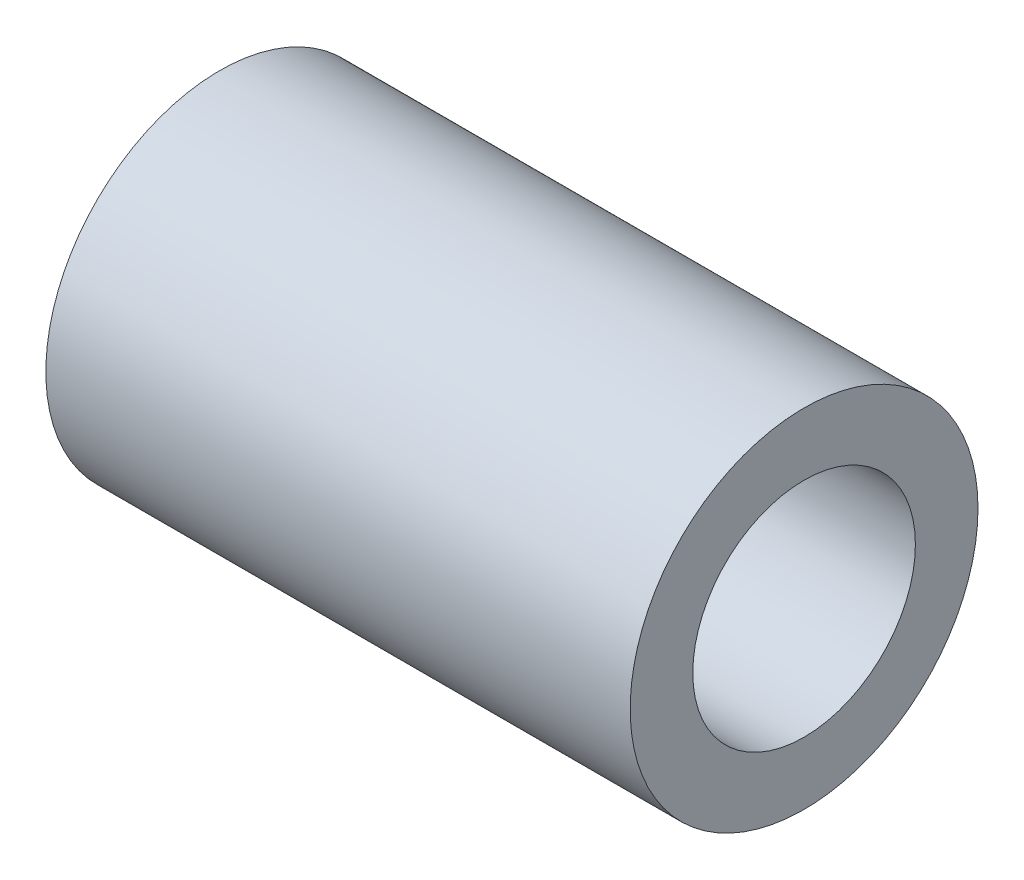
from build123d import *

# Parameters (mm, degrees)
SKETCH_1_R      = 2.5
SKETCH_1_R_2    = 1.6
EXTRUDE_1_DEPTH = 8.4


with BuildPart() as part:
    # 草图1 → 凸台-拉伸1 (new body)
    with BuildSketch(Plane(origin=(0, 0, 0), x_dir=(0, 0, -1), z_dir=(1, 0, 0))):
        Circle(SKETCH_1_R)
        Circle(SKETCH_1_R_2, mode=Mode.SUBTRACT)
    extrude(amount=EXTRUDE_1_DEPTH)


solid = part.part
